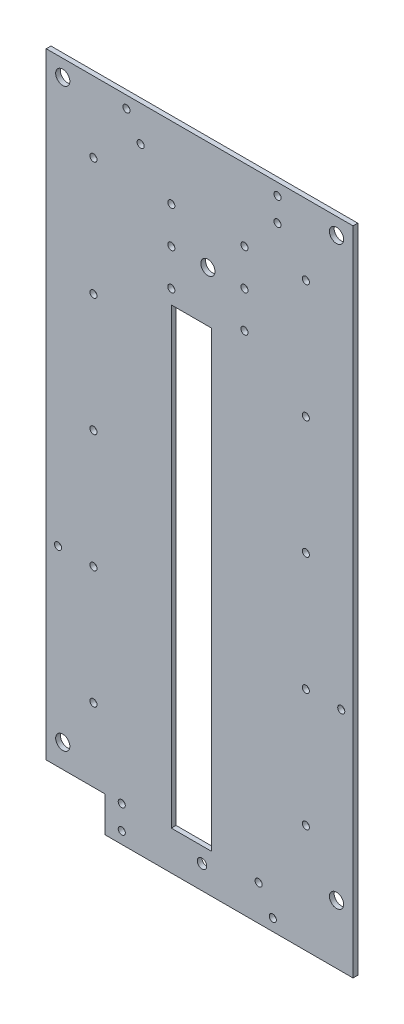
from build123d import *

# Parameters (mm, degrees)
ESQUISSE1_R      = 3
ESQUISSE1_R_2    = 1.5
ESQUISSE1_W      = 17
ESQUISSE1_H      = 192
EXTRUSION1_DEPTH = 2
ESQUISSE3_R      = 1.5
ESQUISSE3_R_2    = 2
EXTRUSION2_DEPTH = 10


with BuildPart() as part:
    # Esquisse1 → Extrusion1 (new body)
    with BuildSketch(Plane.XY):
        Polygon((1.932476129, -483.38221942), (106.932476129, -483.38221942), (106.932476129, -207.38221942), (-23.067523871, -207.38221942), (-23.067523871, -468.38221942), (1.932476129, -468.38221942), align=None)
        with Locations((-16.067523871, -214.38221942)):
            Circle(ESQUISSE1_R, mode=Mode.SUBTRACT)
        with Locations(Location((8.932476129, -468.38221942, 0), (0, 0, 180))):
            Circle(ESQUISSE1_R_2, mode=Mode.SUBTRACT)
        with Locations((10.932476129, -212.38221942)):
            Circle(ESQUISSE1_R_2, mode=Mode.SUBTRACT)
        with Locations(Location((8.932476129, -478.38221942, 0), (0, 0, 180))):
            Circle(ESQUISSE1_R_2, mode=Mode.SUBTRACT)
        with Locations((60.932476129, -268.88221942)):
            Circle(ESQUISSE1_R_2, mode=Mode.SUBTRACT)
        with Locations((29.932476129, -268.88221942)):
            Circle(ESQUISSE1_R_2, mode=Mode.SUBTRACT)
        with Locations((29.932476129, -237.88221942)):
            Circle(ESQUISSE1_R_2, mode=Mode.SUBTRACT)
        with Locations((60.932476129, -237.88221942)):
            Circle(ESQUISSE1_R_2, mode=Mode.SUBTRACT)
        with Locations((29.932476129, -253.38221942)):
            Circle(ESQUISSE1_R_2, mode=Mode.SUBTRACT)
        with Locations((60.932476129, -253.38221942)):
            Circle(ESQUISSE1_R_2, mode=Mode.SUBTRACT)
        with Locations((16.932476129, -222.38221942)):
            Circle(ESQUISSE1_R_2, mode=Mode.SUBTRACT)
        with Locations((72.932476129, -478.38221942)):
            Circle(ESQUISSE1_R_2, mode=Mode.SUBTRACT)
        with Locations((45.432476129, -253.38221942)):
            Circle(ESQUISSE1_R, mode=Mode.SUBTRACT)
        with Locations((66.932476129, -468.38221942)):
            Circle(ESQUISSE1_R_2, mode=Mode.SUBTRACT)
        with Locations((74.932476129, -222.38221942)):
            Circle(ESQUISSE1_R_2, mode=Mode.SUBTRACT)
        with Locations(Location((99.932476129, -214.38221942, 0), (0, 0, 180))):
            Circle(ESQUISSE1_R, mode=Mode.SUBTRACT)
        with Locations((74.932476129, -212.38221942)):
            Circle(ESQUISSE1_R_2, mode=Mode.SUBTRACT)
        with Locations(Location((-16.067523871, -458.38221942, 0), (0, 0, 180))):
            Circle(ESQUISSE1_R, mode=Mode.SUBTRACT)
        with Locations((99.932476129, -458.38221942)):
            Circle(ESQUISSE1_R, mode=Mode.SUBTRACT)
        with Locations((38.432476129, -370.88221942)):
            Rectangle(ESQUISSE1_W, ESQUISSE1_H, mode=Mode.SUBTRACT)
    extrude(amount=EXTRUSION1_DEPTH)

    # Esquisse3 → Extrusion2 (cut)
    with BuildSketch(Plane.XY.offset(2)):
        with Locations((-3.067523871, -237.38221942)):
            Circle(ESQUISSE3_R)
        with Locations((86.932476129, -237.38221942)):
            Circle(ESQUISSE3_R)
        with Locations((86.932476129, -437.38221942)):
            Circle(ESQUISSE3_R)
        with Locations((-3.067523871, -437.38221942)):
            Circle(ESQUISSE3_R)
        with Locations((-3.067523871, -337.38221942)):
            Circle(ESQUISSE3_R)
        with Locations((86.932476129, -337.38221942)):
            Circle(ESQUISSE3_R)
        with Locations((-3.067523871, -287.38221942)):
            Circle(ESQUISSE3_R)
        with Locations((86.932476129, -287.38221942)):
            Circle(ESQUISSE3_R)
        with Locations((-3.067523871, -387.38221942)):
            Circle(ESQUISSE3_R)
        with Locations((86.932476129, -387.38221942)):
            Circle(ESQUISSE3_R)
        with Locations((42.932476129, -473.38221942)):
            Circle(ESQUISSE3_R_2)
        with Locations((-18.067523871, -203.38221942)):
            Circle(ESQUISSE3_R)
        with Locations((101.932476129, -203.38221942)):
            Circle(ESQUISSE3_R)
        with Locations((-18.067523871, -387.38221942)):
            Circle(ESQUISSE3_R)
        with Locations((101.932476129, -387.38221942)):
            Circle(ESQUISSE3_R)
    extrude(amount=-EXTRUSION2_DEPTH, mode=Mode.SUBTRACT)


solid = part.part
